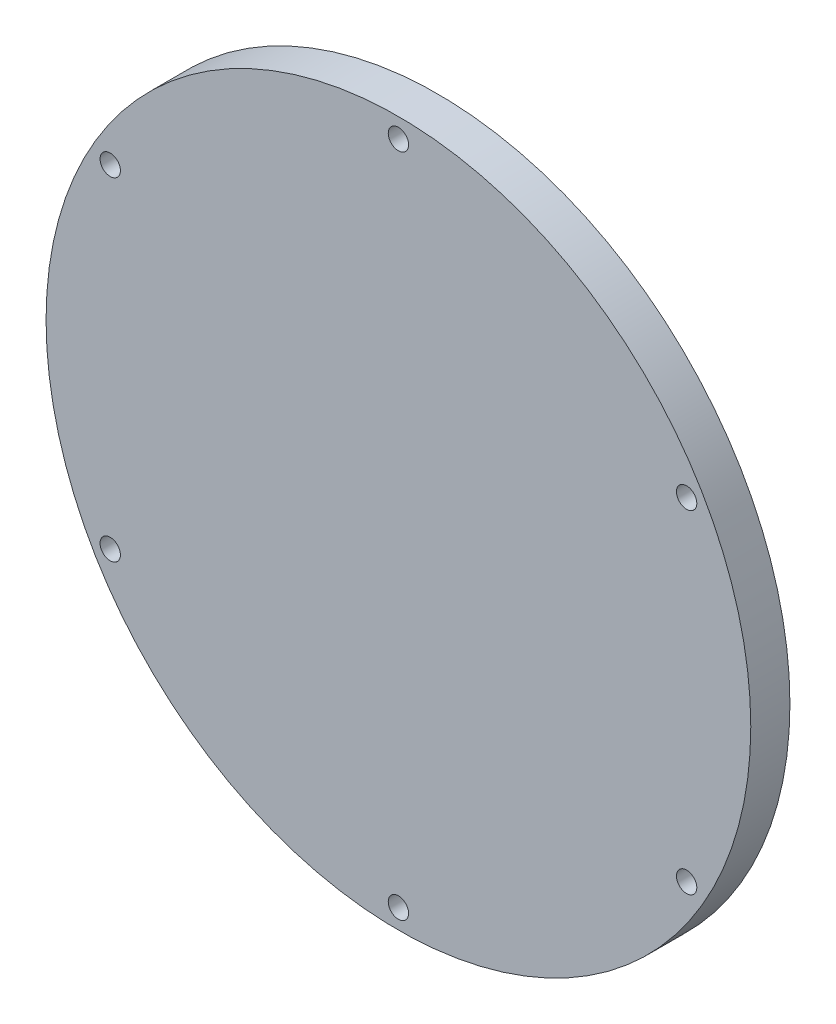
from build123d import *

# Parameters (mm, degrees)
SKETCH_1_R          = 57.15
EXTRUDE_1_DEPTH     = 6.35
SKETCH_2_R          = 1.651
CUT_EXTRUDE_1_DEPTH = 82.071372876


with BuildPart() as part:
    # 草图1 → 凸台-拉伸1 (new body)
    with BuildSketch(Plane.XY):
        Circle(SKETCH_1_R)
    extrude(amount=EXTRUDE_1_DEPTH)

    # 草图2 → 切除-拉伸1 (cut, through all)
    with BuildSketch(Plane(origin=(0, 0, 0), x_dir=(-1, 0, 0), z_dir=(0, 0, -1))):
        with Locations((-46.743721169, 26.9875)):
            Circle(SKETCH_2_R)
        with Locations((0, 53.975)):
            Circle(SKETCH_2_R)
        with Locations((46.743721169, 26.9875)):
            Circle(SKETCH_2_R)
        with Locations((46.743721169, -26.9875)):
            Circle(SKETCH_2_R)
        with Locations((0, -53.975)):
            Circle(SKETCH_2_R)
        with Locations((-46.743721169, -26.9875)):
            Circle(SKETCH_2_R)
    extrude(amount=-CUT_EXTRUDE_1_DEPTH, mode=Mode.SUBTRACT)


solid = part.part
